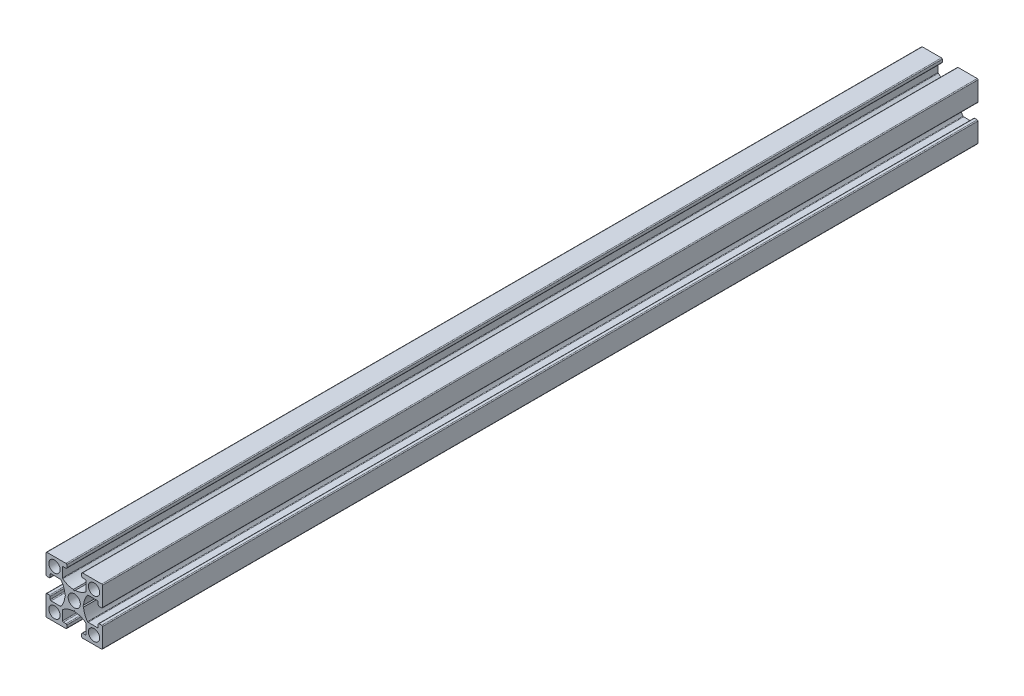
from build123d import *

# Parameters (mm, degrees)
MODEL_R             = 2.15
MODEL_R_2           = 2
EXTRUDE_1_DEPTH     = 310
SKETCH_1_R          = 2.5
CUT_EXTRUDE_1_DEPTH = 2335.375591913


with BuildPart() as part:
    # Model → 보스-돌출1 (new body)
    with BuildSketch(Plane.XY):
        with BuildLine():
            Line((2307.763927197, 1192.134297913), (2307.763927197, 1195.391548465))
            ThreePointArc((2307.763927197, 1195.391548465), (2307.676059232, 1195.603680499), (2307.463927197, 1195.691548465))
            Line((2307.463927197, 1195.691548465), (2306.563927197, 1195.691548465))
            ThreePointArc((2306.563927197, 1195.691548465), (2306.351795163, 1195.779416431), (2306.263927197, 1195.991548465))
            Line((2306.263927197, 1195.991548465), (2306.263927197, 1196.891548465))
            ThreePointArc((2306.263927197, 1196.891548465), (2306.351795163, 1197.103680499), (2306.563927197, 1197.191548465))
            Line((2306.563927197, 1197.191548465), (2313.313927197, 1197.191548465))
            ThreePointArc((2313.313927197, 1197.191548465), (2313.526059232, 1197.103680499), (2313.613927197, 1196.891548465))
            Line((2313.613927197, 1196.891548465), (2313.613927197, 1190.141548465))
            ThreePointArc((2313.613927197, 1190.141548465), (2313.526059232, 1189.929416431), (2313.313927197, 1189.841548465))
            Line((2313.313927197, 1189.841548465), (2312.413927197, 1189.841548465))
            ThreePointArc((2312.413927197, 1189.841548465), (2312.201795163, 1189.929416431), (2312.113927197, 1190.141548465))
            Line((2312.113927197, 1190.141548465), (2312.113927197, 1191.041548465))
            ThreePointArc((2312.113927197, 1191.041548465), (2312.026059232, 1191.253680499), (2311.813927197, 1191.341548465))
            Line((2311.813927197, 1191.341548465), (2308.556676645, 1191.341548465))
            ThreePointArc((2308.556676645, 1191.341548465), (2308.426234796, 1191.311705686), (2308.321744595, 1191.228114625))
            ThreePointArc((2308.321744595, 1191.228114625), (2307.328306374, 1189.47356999), (2306.921204563, 1187.498825831))
            Line((2306.921204563, 1187.498825831), (2306.613927197, 1187.191548465))
            Line((2306.613927197, 1187.191548465), (2306.921204563, 1186.884271099))
            ThreePointArc((2306.921204563, 1186.884271099), (2307.328306374, 1184.90952694), (2308.321744595, 1183.154982305))
            ThreePointArc((2308.321744595, 1183.154982305), (2308.426234796, 1183.071391244), (2308.556676645, 1183.041548465))
            Line((2308.556676645, 1183.041548465), (2311.813927197, 1183.041548465))
            ThreePointArc((2311.813927197, 1183.041548465), (2312.026059232, 1183.129416431), (2312.113927197, 1183.341548465))
            Line((2312.113927197, 1183.341548465), (2312.113927197, 1184.241548465))
            ThreePointArc((2312.113927197, 1184.241548465), (2312.201795163, 1184.453680499), (2312.413927197, 1184.541548465))
            Line((2312.413927197, 1184.541548465), (2313.313927197, 1184.541548465))
            ThreePointArc((2313.313927197, 1184.541548465), (2313.526059232, 1184.453680499), (2313.613927197, 1184.241548465))
            Line((2313.613927197, 1184.241548465), (2313.613927197, 1177.491548465))
            ThreePointArc((2313.613927197, 1177.491548465), (2313.526059232, 1177.279416431), (2313.313927197, 1177.191548465))
            Line((2313.313927197, 1177.191548465), (2306.563927197, 1177.191548465))
            ThreePointArc((2306.563927197, 1177.191548465), (2306.351795163, 1177.279416431), (2306.263927197, 1177.491548465))
            Line((2306.263927197, 1177.491548465), (2306.263927197, 1178.391548465))
            ThreePointArc((2306.263927197, 1178.391548465), (2306.351795163, 1178.603680499), (2306.563927197, 1178.691548465))
            Line((2306.563927197, 1178.691548465), (2307.463927197, 1178.691548465))
            ThreePointArc((2307.463927197, 1178.691548465), (2307.676059232, 1178.779416431), (2307.763927197, 1178.991548465))
            Line((2307.763927197, 1178.991548465), (2307.763927197, 1182.248799017))
            ThreePointArc((2307.763927197, 1182.248799017), (2307.734084418, 1182.379240866), (2307.650493357, 1182.483731067))
            ThreePointArc((2307.650493357, 1182.483731067), (2305.895948722, 1183.477169289), (2303.921204563, 1183.884271099))
            Line((2303.921204563, 1183.884271099), (2303.613927197, 1184.191548465))
            Line((2303.613927197, 1184.191548465), (2303.306649831, 1183.884271099))
            ThreePointArc((2303.306649831, 1183.884271099), (2301.331905673, 1183.477169289), (2299.577361038, 1182.483731067))
            ThreePointArc((2299.577361038, 1182.483731067), (2299.493769977, 1182.379240866), (2299.463927197, 1182.248799017))
            Line((2299.463927197, 1182.248799017), (2299.463927197, 1178.991548465))
            ThreePointArc((2299.463927197, 1178.991548465), (2299.551795163, 1178.779416431), (2299.763927197, 1178.691548465))
            Line((2299.763927197, 1178.691548465), (2300.663927197, 1178.691548465))
            ThreePointArc((2300.663927197, 1178.691548465), (2300.876059232, 1178.603680499), (2300.963927197, 1178.391548465))
            Line((2300.963927197, 1178.391548465), (2300.963927197, 1177.491548465))
            ThreePointArc((2300.963927197, 1177.491548465), (2300.876059232, 1177.279416431), (2300.663927197, 1177.191548465))
            Line((2300.663927197, 1177.191548465), (2293.913927197, 1177.191548465))
            ThreePointArc((2293.913927197, 1177.191548465), (2293.701795163, 1177.279416431), (2293.613927197, 1177.491548465))
            Line((2293.613927197, 1177.491548465), (2293.613927197, 1184.241548465))
            ThreePointArc((2293.613927197, 1184.241548465), (2293.701795163, 1184.453680499), (2293.913927197, 1184.541548465))
            Line((2293.913927197, 1184.541548465), (2294.813927197, 1184.541548465))
            ThreePointArc((2294.813927197, 1184.541548465), (2295.026059232, 1184.453680499), (2295.113927197, 1184.241548465))
            Line((2295.113927197, 1184.241548465), (2295.113927197, 1183.341548465))
            ThreePointArc((2295.113927197, 1183.341548465), (2295.201795163, 1183.129416431), (2295.413927197, 1183.041548465))
            Line((2295.413927197, 1183.041548465), (2298.671177749, 1183.041548465))
            ThreePointArc((2298.671177749, 1183.041548465), (2298.801619599, 1183.071391244), (2298.906109799, 1183.154982305))
            ThreePointArc((2298.906109799, 1183.154982305), (2299.899548021, 1184.90952694), (2300.306649831, 1186.884271099))
            Line((2300.306649831, 1186.884271099), (2300.613927197, 1187.191548465))
            Line((2300.613927197, 1187.191548465), (2300.306649831, 1187.498825831))
            ThreePointArc((2300.306649831, 1187.498825831), (2299.899548021, 1189.47356999), (2298.906109799, 1191.228114625))
            ThreePointArc((2298.906109799, 1191.228114625), (2298.801619599, 1191.311705686), (2298.671177749, 1191.341548465))
            Line((2298.671177749, 1191.341548465), (2295.413927197, 1191.341548465))
            ThreePointArc((2295.413927197, 1191.341548465), (2295.201795163, 1191.253680499), (2295.113927197, 1191.041548465))
            Line((2295.113927197, 1191.041548465), (2295.113927197, 1190.141548465))
            ThreePointArc((2295.113927197, 1190.141548465), (2295.026059232, 1189.929416431), (2294.813927197, 1189.841548465))
            Line((2294.813927197, 1189.841548465), (2293.913927197, 1189.841548465))
            ThreePointArc((2293.913927197, 1189.841548465), (2293.701795163, 1189.929416431), (2293.613927197, 1190.141548465))
            Line((2293.613927197, 1190.141548465), (2293.613927197, 1196.891548465))
            ThreePointArc((2293.613927197, 1196.891548465), (2293.701795163, 1197.103680499), (2293.913927197, 1197.191548465))
            Line((2293.913927197, 1197.191548465), (2300.663927197, 1197.191548465))
            ThreePointArc((2300.663927197, 1197.191548465), (2300.876059232, 1197.103680499), (2300.963927197, 1196.891548465))
            Line((2300.963927197, 1196.891548465), (2300.963927197, 1195.991548465))
            ThreePointArc((2300.963927197, 1195.991548465), (2300.876059232, 1195.779416431), (2300.663927197, 1195.691548465))
            Line((2300.663927197, 1195.691548465), (2299.763927197, 1195.691548465))
            ThreePointArc((2299.763927197, 1195.691548465), (2299.551795163, 1195.603680499), (2299.463927197, 1195.391548465))
            Line((2299.463927197, 1195.391548465), (2299.463927197, 1192.134297913))
            ThreePointArc((2299.463927197, 1192.134297913), (2299.493769977, 1192.003856063), (2299.577361038, 1191.899365863))
            ThreePointArc((2299.577361038, 1191.899365863), (2301.331905673, 1190.905927641), (2303.306649831, 1190.498825831))
            Line((2303.306649831, 1190.498825831), (2303.613927197, 1190.191548465))
            Line((2303.613927197, 1190.191548465), (2303.921204563, 1190.498825831))
            ThreePointArc((2303.921204563, 1190.498825831), (2305.895948722, 1190.905927641), (2307.650493357, 1191.899365863))
            ThreePointArc((2307.650493357, 1191.899365863), (2307.734084418, 1192.003856063), (2307.763927197, 1192.134297913))
        make_face()
        with Locations((2303.613927197, 1187.191548465)):
            Circle(MODEL_R, mode=Mode.SUBTRACT)
        with Locations((2296.613927197, 1194.191548465)):
            Circle(MODEL_R_2, mode=Mode.SUBTRACT)
        with Locations((2296.613927197, 1180.191548465)):
            Circle(MODEL_R_2, mode=Mode.SUBTRACT)
        with Locations((2310.613927197, 1194.191548465)):
            Circle(MODEL_R_2, mode=Mode.SUBTRACT)
        with Locations((2310.613927197, 1180.191548465)):
            Circle(MODEL_R_2, mode=Mode.SUBTRACT)
    extrude(amount=EXTRUDE_1_DEPTH)

    # 스케치1 → 컷-돌출1 (cut, through all)
    with BuildSketch(Plane(origin=(0, 1197.191548465, 0), x_dir=(1, 0, 0), z_dir=(0, 1, 0))):
        with Locations(Location((2303.613927197, -30, 0), (0, 0, 270))):
            Circle(SKETCH_1_R)
        with Locations(Location((2303.613927197, -60, 0), (0, 0, 270))):
            Circle(SKETCH_1_R)
        with Locations(Location((2303.613927197, -155, 0), (0, 0, 270))):
            Circle(SKETCH_1_R)
        with Locations(Location((2303.613927197, -90, 0), (0, 0, 270))):
            Circle(SKETCH_1_R)
        with Locations(Location((2303.613927197, -220, 0), (0, 0, 270))):
            Circle(SKETCH_1_R)
        with Locations(Location((2303.613927197, -250, 0), (0, 0, 270))):
            Circle(SKETCH_1_R)
        with Locations(Location((2303.613927197, -280, 0), (0, 0, 270))):
            Circle(SKETCH_1_R)
    extrude(amount=-CUT_EXTRUDE_1_DEPTH, mode=Mode.SUBTRACT)


solid = part.part
